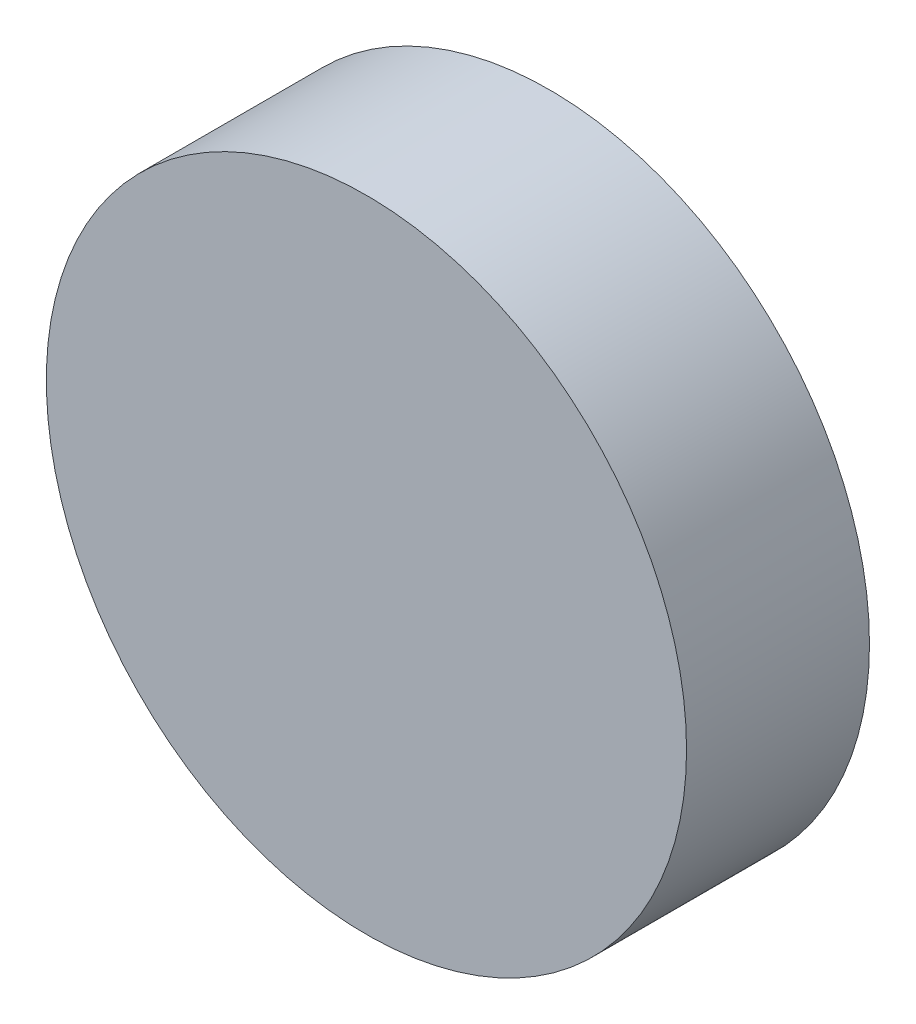
from build123d import *

# Parameters (mm, degrees)
SKETCH_1_R      = 35
EXTRUDE_1_DEPTH = 20


with BuildPart() as part:
    # 草图1 → 凸台-拉伸1 (new body)
    with BuildSketch(Plane.XY):
        Circle(SKETCH_1_R)
    extrude(amount=EXTRUDE_1_DEPTH)


solid = part.part
